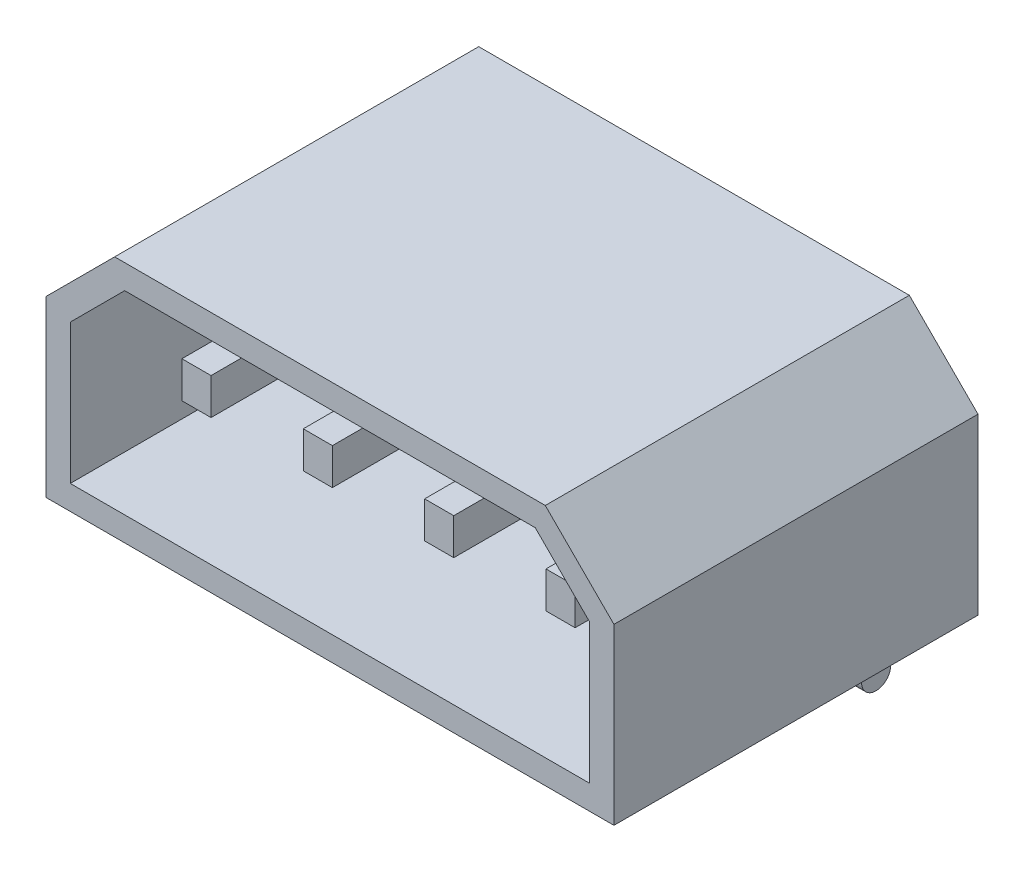
from build123d import *

# Parameters (mm, degrees)
EXTRUDE_THIN1_DEPTH = 7.5
BOSS_EXTRUDE1_DEPTH = 3
BOSS_EXTRUDE2_DEPTH = 0.3
LPATTERN1_COUNT     = 4
LPATTERN1_PITCH     = 2.5


with BuildPart() as part:
    # Sketch1 → Extrude-Thin1 (new body)
    with BuildSketch(Plane.XY):
        Polygon((0, 0), (11.7, 0), (11.7, 3.585786438), (10.285786438, 5), (1.414213562, 5), (0, 3.585786438), align=None)
        Polygon((0.5, 0.5), (11.2, 0.5), (11.2, 3.378679656), (10.078679656, 4.5), (1.621320344, 4.5), (0.5, 3.378679656), align=None, mode=Mode.SUBTRACT)
    extrude(amount=EXTRUDE_THIN1_DEPTH)

    # Sketch2 → Boss-Extrude1 (add)
    with BuildSketch(Plane(origin=(0, 0, 0), x_dir=(-1, 0, 0), z_dir=(0, 0, -1))):
        Polygon((0, 0), (0, 3.585786438), (-1.414213562, 5), (-10.285786438, 5), (-11.7, 3.585786438), (-11.7, 0), align=None)
    extrude(amount=-BOSS_EXTRUDE1_DEPTH)

    # Sketch3 → Boss-Extrude2 (add, symmetric)
    with BuildSketch(Plane(origin=(9.6, 0, 0), x_dir=(0, 0, -1), z_dir=(1, 0, 0))):
        with BuildLine():
            Line((-6.5, 2.875), (0, 2.875))
            Line((0, 2.875), (0, -1.8))
            ThreePointArc((0, -1.8), (-0.3, -2.1), (-0.6, -1.8))
            Line((-0.6, -1.8), (-0.6, 2.125))
            Line((-0.6, 2.125), (-6.5, 2.125))
            Line((-6.5, 2.125), (-6.5, 2.875))
        make_face()
    boss_extrude2 = extrude(amount=BOSS_EXTRUDE2_DEPTH, both=True)

    # LPattern1: Boss-Extrude2 ×4
    with Locations(*[(-i * LPATTERN1_PITCH, 0, 0) for i in range(1, LPATTERN1_COUNT)]):
        add(boss_extrude2)


solid = part.part
